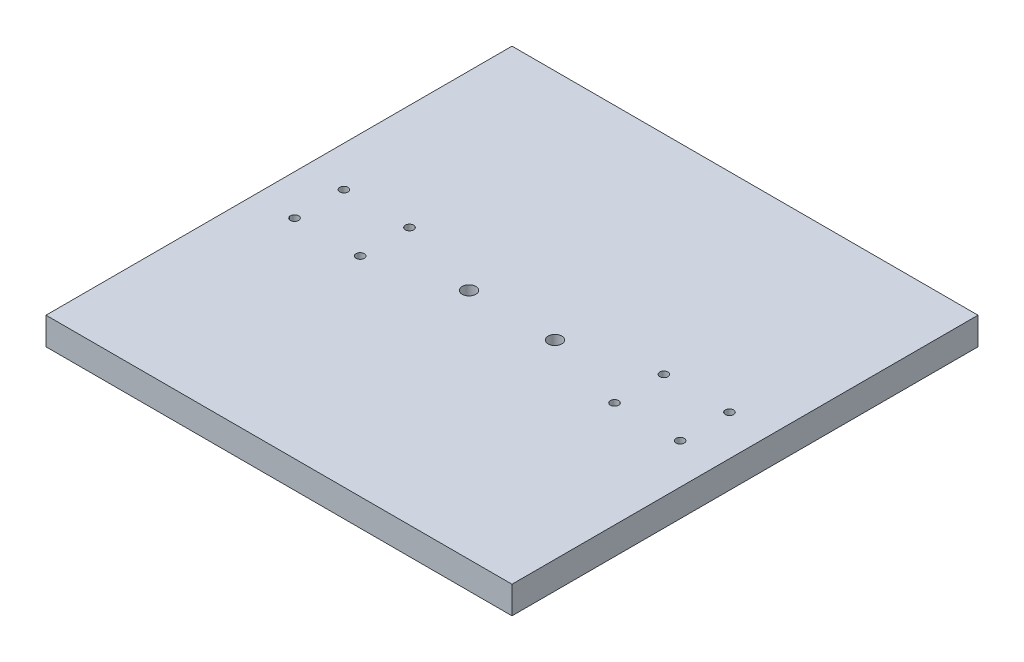
from build123d import *

# Parameters (mm, degrees)
SKETCH2_W               = 170
SKETCH2_H               = 170
BOSS_EXTRUDE1_DEPTH     = 10
CUT_EXTRUDE2_DEPTH      = 121.623380818
CUT_EXTRUDE2_DEPTH_BACK = 121.623380818
SKETCH4_R               = 1.5
SKETCH6_R               = 2.5
CUT_EXTRUDE6_DEPTH      = 10


with BuildPart() as part:
    # Sketch2 → Boss-Extrude1 (new body)
    with BuildSketch(Plane(origin=(0, 0, 0), x_dir=(1, 0, 0), z_dir=(0, 1, 0))):
        Rectangle(SKETCH2_W, SKETCH2_H)
    extrude(amount=BOSS_EXTRUDE1_DEPTH)

    # Sketch4 → Cut-Extrude2 (cut, two sides: drawn at the far end of the back side and taken through both)
    with BuildSketch(Plane(origin=(0, 0, 0), x_dir=(-1, 0, 0), z_dir=(0, -1, 0)).offset(-CUT_EXTRUDE2_DEPTH_BACK)):
        with Locations(Location((-70.33, -9, 0), (0, 0, 270))):
            Circle(SKETCH4_R)
        with Locations(Location((-70.33, 9, 0), (0, 0, 270))):
            Circle(SKETCH4_R)
        with Locations(Location((70.33, 9, 0), (0, 0, 270))):
            Circle(SKETCH4_R)
        with Locations(Location((70.33, -9, 0), (0, 0, 270))):
            Circle(SKETCH4_R)
        with Locations(Location((46.4, 9, 0), (0, 0, 270))):
            Circle(SKETCH4_R)
        with Locations(Location((46.4, -9, 0), (0, 0, 270))):
            Circle(SKETCH4_R)
        with Locations(Location((-46.4, -9, 0), (0, 0, 270))):
            Circle(SKETCH4_R)
        with Locations(Location((-46.4, 9, 0), (0, 0, 270))):
            Circle(SKETCH4_R)
    extrude(amount=CUT_EXTRUDE2_DEPTH + CUT_EXTRUDE2_DEPTH_BACK, mode=Mode.SUBTRACT)

    # Sketch6 → Cut-Extrude6 (cut)
    with BuildSketch(Plane.XZ):
        with Locations(Location((-15.68, 0, 0), (0, 0, 270))):
            Circle(SKETCH6_R)
        with Locations(Location((15.68, 0, 0), (0, 0, 270))):
            Circle(SKETCH6_R)
    extrude(amount=-CUT_EXTRUDE6_DEPTH, mode=Mode.SUBTRACT)


solid = part.part
